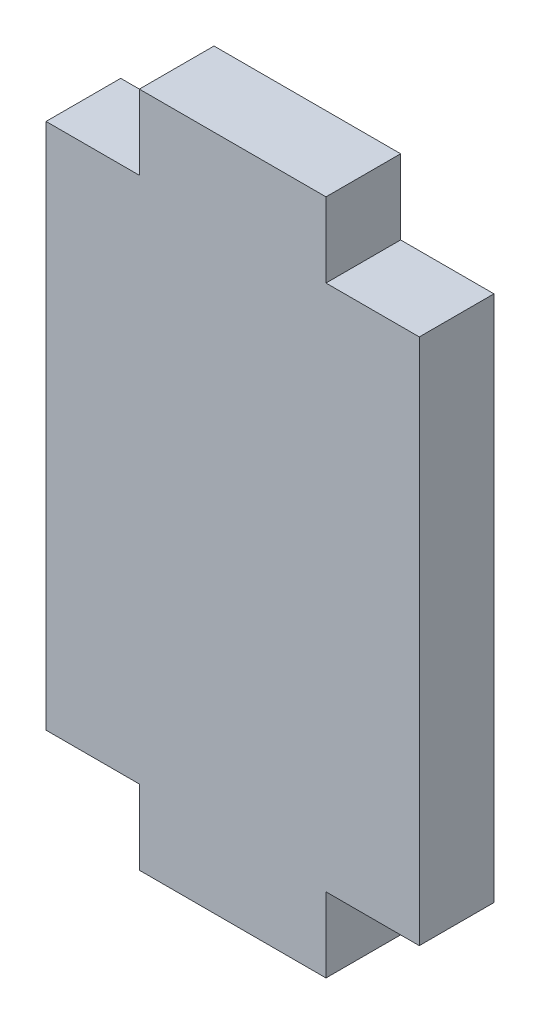
from build123d import *

# Parameters (mm, degrees)
BOSS_EXTRUDE1_DEPTH = 4


with BuildPart() as part:
    # Sketch1 → Boss-Extrude1 (new body)
    with BuildSketch(Plane.XY):
        Polygon((-10, 14.125), (-10, -14.125), (-5, -14.125), (-5, -18.125), (5, -18.125), (5, -14.125), (10, -14.125), (10, 14.125), (5, 14.125), (5, 18.125), (-5, 18.125), (-5, 14.125), align=None)
    extrude(amount=BOSS_EXTRUDE1_DEPTH)


solid = part.part
